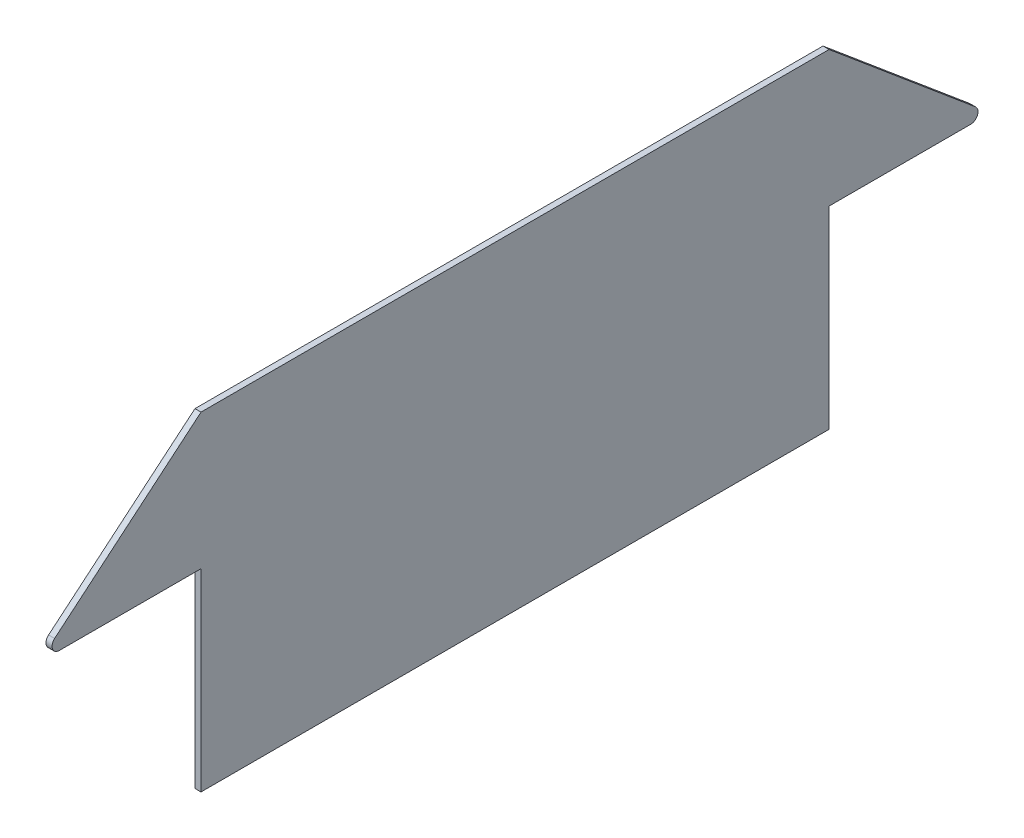
from build123d import *

# Parameters (mm, degrees)
BOSS_EXTRUDE1_DEPTH = 6.35
FILLET1_R           = 7.62


with BuildPart() as part:
    # Sketch1 → Boss-Extrude1 (new body)
    with BuildSketch(Plane(origin=(0, 0, 0), x_dir=(0, 0, -1), z_dir=(1, 0, 0))):
        Polygon((330, 101.6), (482.4, 101.6), (499.846481614, 101.6), (486.481701322, 112.814382214), (330, 244.118120079), (-330, 244.118120079), (-499.846481614, 101.6), (-482.4, 101.6), (-330, 101.6), (-330, -101.6), (330, -101.6), align=None)
    extrude(amount=BOSS_EXTRUDE1_DEPTH)

    # Fillet1
    fillet1_edges = [part.edges().sort_by_distance(p)[0] for p in [
        (3.175, 101.6, 499.846481614),
        (3.175, 101.6, -499.846481614),
    ]]
    fillet(fillet1_edges, radius=FILLET1_R)


solid = part.part
